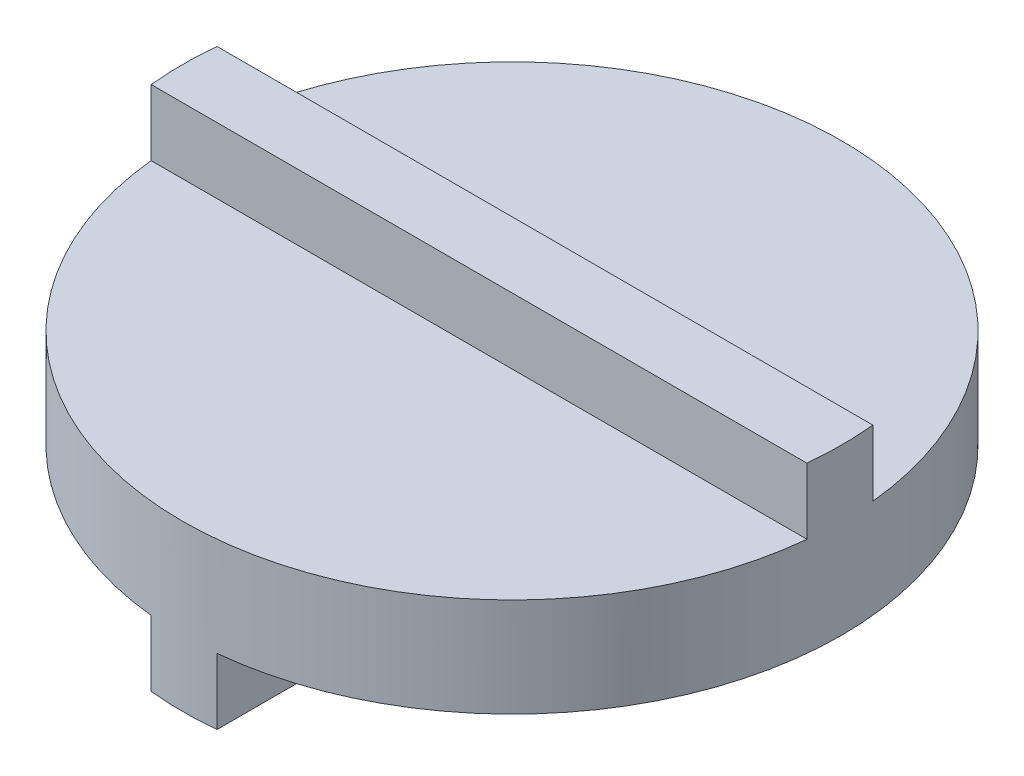
from build123d import *
from build123d.topology import SkipClean

# Parameters (mm, degrees)
SKETCH1_R           = 50
BOSS_EXTRUDE1_DEPTH = 15
BOSS_EXTRUDE2_DEPTH = 10
BOSS_EXTRUDE3_START = 10
BOSS_EXTRUDE3_DEPTH = 10


with BuildPart() as part:
    # Sketch1 → Boss-Extrude1 (new body)
    with BuildSketch(Plane(origin=(0, 0, 0), x_dir=(1, 0, 0), z_dir=(0, 1, 0))):
        with Locations(Location((0, 0, 0), (0, 0, 270))):
            Circle(SKETCH1_R)
    extrude(amount=BOSS_EXTRUDE1_DEPTH)

    # Sketch2 → Boss-Extrude2 (add)
    with SkipClean():  # the faces are left unmerged after this step: merging them gives an invalid solid
        with BuildSketch(Plane(origin=(0, 15, 0), x_dir=(1, 0, 0), z_dir=(0, 1, 0))):
            with BuildLine():
                Line((-49.749371855, 5), (49.749371855, 5))
                ThreePointArc((49.749371855, 5), (50, 0), (49.749371855, -5))
                Line((49.749371855, -5), (-49.749371855, -5))
                ThreePointArc((-49.749371855, -5), (-50, 0), (-49.749371855, 5))
            make_face()
        extrude(amount=BOSS_EXTRUDE2_DEPTH)

    # Sketch3 → Boss-Extrude3 (add)
    with SkipClean():  # the faces are left unmerged after this step: merging them gives an invalid solid
        with BuildSketch(Plane.XZ.offset(BOSS_EXTRUDE3_START)):
            with BuildLine():
                ThreePointArc((-5, -49.749371855), (0, -50), (5, -49.749371855))
                Line((5, -49.749371855), (5, 49.749371855))
                ThreePointArc((5, 49.749371855), (0, 50), (-5, 49.749371855))
                Line((-5, 49.749371855), (-5, -49.749371855))
            make_face()
        extrude(amount=-BOSS_EXTRUDE3_DEPTH)


solid = part.part
